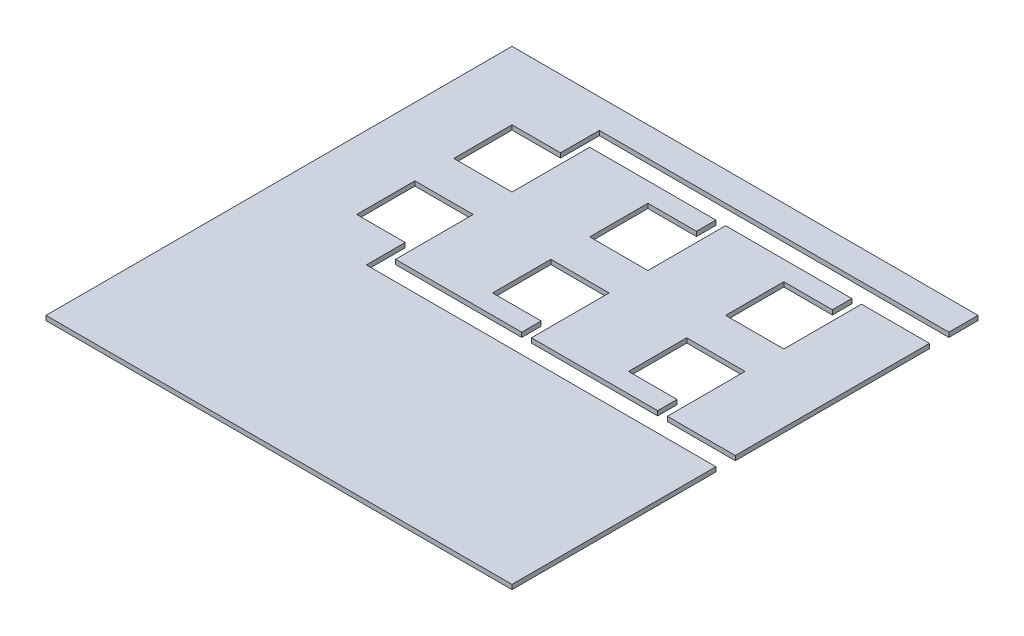
from build123d import *

# Parameters (mm, degrees)
SKETCH1_W            = 304.8
SKETCH1_H            = 304.8
BOSS_EXTRUDE1_DEPTH  = 2.9972
SKETCH2_W            = 38.1
SKETCH2_H            = 38.1
CUT_EXTRUDE1_DEPTH   = 2.9972
LPATTERN1_COUNT      = 3
LPATTERN1_PITCH      = 88.9
LPATTERN1_COUNT_DIR2 = 2
LPATTERN1_PITCH_DIR2 = 63.5
CUT_EXTRUDE2_DEPTH   = 2.9972


with BuildPart() as part:
    # Sketch1 → Boss-Extrude1 (new body)
    with BuildSketch(Plane(origin=(0, 0, 0), x_dir=(1, 0, 0), z_dir=(0, 1, 0))):
        Rectangle(SKETCH1_W, SKETCH1_H)
    extrude(amount=BOSS_EXTRUDE1_DEPTH)

    # Sketch2 → Cut-Extrude1 (cut)
    with BuildSketch(Plane(origin=(0, 2.9972, 0), x_dir=(1, 0, 0), z_dir=(0, 1, 0))):
        with Locations((-88.9, 88.9)):
            Rectangle(SKETCH2_W, SKETCH2_H)
    cut_extrude1 = extrude(amount=-CUT_EXTRUDE1_DEPTH, mode=Mode.SUBTRACT)

    # LPattern1: Cut-Extrude1 3 × 2
    with Locations(*[(i * LPATTERN1_PITCH, 0, j * LPATTERN1_PITCH_DIR2) for i in range(LPATTERN1_COUNT) for j in range(LPATTERN1_COUNT_DIR2) if (i, j) != (0, 0)]):
        add(cut_extrude1, mode=Mode.SUBTRACT)

    # Sketch3 → Cut-Extrude2 (cut)
    with BuildSketch(Plane(origin=(0, 2.9972, 0), x_dir=(1, 0, 0), z_dir=(0, 1, 0))):
        Polygon((-69.85, 107.95), (-69.85, 120.65), (12.7, 120.65), (12.7, 107.95), (19.05, 107.95), (19.05, 120.65), (101.6, 120.65), (101.6, 107.95), (107.95, 107.95), (107.95, 120.65), (152.4, 120.65), (152.4, 133.35), (-76.2, 133.35), (-76.2, 107.95), align=None)
        Polygon((-69.85, 6.35), (-69.85, -6.35), (12.7, -6.35), (12.7, 6.35), (19.05, 6.35), (19.05, -6.35), (101.6, -6.35), (101.6, 6.35), (107.95, 6.35), (107.95, -6.35), (152.4, -6.35), (152.4, -19.05), (-76.2, -19.05), (-76.2, 6.35), align=None)
    extrude(amount=-CUT_EXTRUDE2_DEPTH, mode=Mode.SUBTRACT)


solid = part.part
